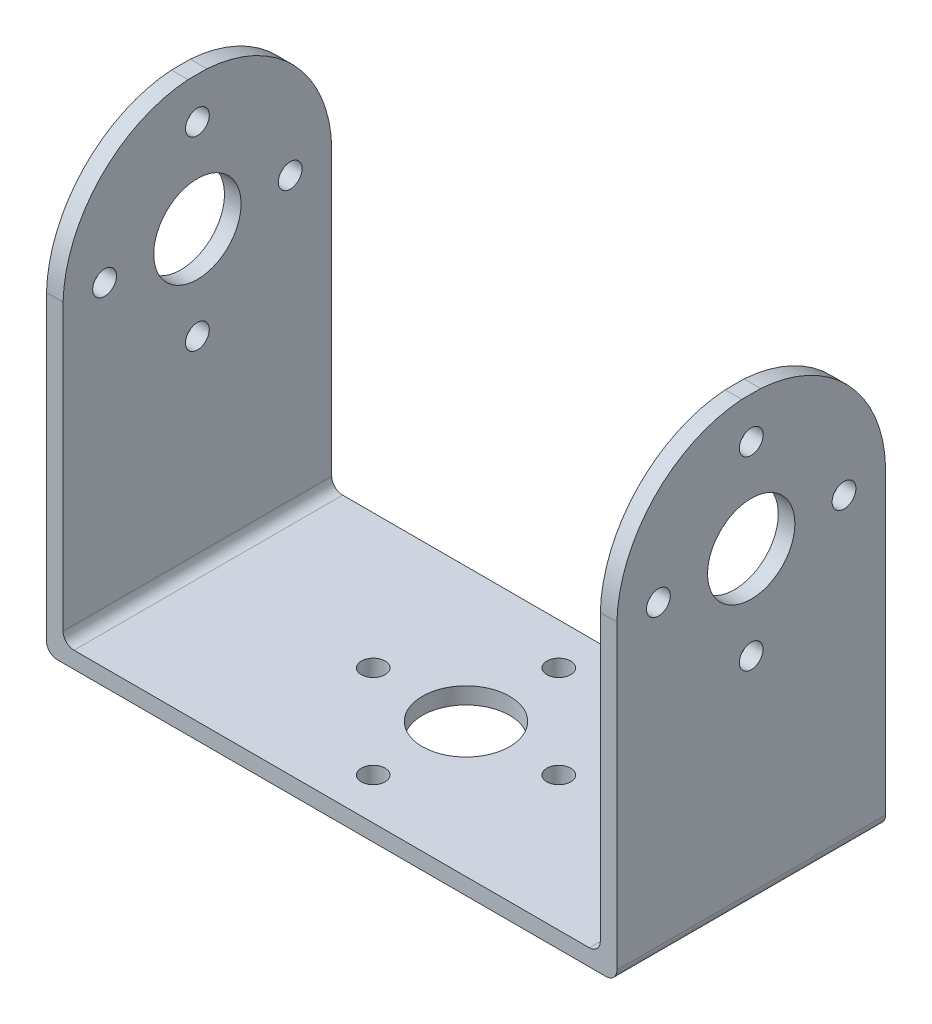
from build123d import *

# Parameters (mm, degrees)
BOSS_EXTRUDE1_DEPTH = 24.61
SKETCH2_R           = 4
CUT_EXTRUDE5_DEPTH  = 20
SKETCH4_R           = 1.09
CUT_EXTRUDE6_DEPTH  = 100
CIRPATTERN1_COUNT   = 4
SKETCH5_R           = 4
CUT_EXTRUDE7_DEPTH  = 50
SKETCH6_R           = 1.09
CUT_EXTRUDE8_DEPTH  = 50
CIRPATTERN2_COUNT   = 4
FILLET1_R           = 1
SKETCH7_W           = 24.61
SKETCH7_H           = 17.78
CUT_EXTRUDE9_DEPTH  = 100


with BuildPart() as part:
    # Sketch1 → Boss-Extrude1 (new body)
    with BuildSketch(Plane.XY):
        Polygon((-26.125, 58.34), (-26.125, 0), (26.125, 0), (26.125, 58.34), (24.605, 58.34), (24.605, 1.52), (-24.605, 1.52), (-24.605, 58.34), align=None)
    extrude(amount=BOSS_EXTRUDE1_DEPTH)

    # Sketch2 → Cut-Extrude5 (cut)
    with BuildSketch(Plane.ZY.offset(26.125)):
        with Locations(Location((12.305, 28.28, 0), (0, 0, 270))):
            Circle(SKETCH2_R)
        with BuildLine():
            Line((-0.005, 28.28), (-0.002957418, 40.56))
            Line((-0.002957418, 40.56), (11.446105362, 40.56))
            ThreePointArc((11.446105362, 40.56), (3.301970149, 36.675329267), (-0.005, 28.28))
        make_face()
        with BuildLine():
            Line((24.612957418, 40.56), (24.615, 28.28))
            ThreePointArc((24.615, 28.28), (21.308029851, 36.675329267), (13.163894638, 40.56))
            Line((13.163894638, 40.56), (24.612957418, 40.56))
        make_face()
    cut_extrude5 = extrude(amount=-CUT_EXTRUDE5_DEPTH, mode=Mode.SUBTRACT)

    # Mirror1: Cut-Extrude5 across plane
    add(cut_extrude5.mirror(Plane(origin=(0, 0, 0), x_dir=(0, 0, 1), z_dir=(1, 0, 0))), mode=Mode.SUBTRACT)

    # Sketch4 → Cut-Extrude6 (cut)
    with BuildSketch(Plane.ZY.offset(26.125)):
        with Locations(Location((12.305, 36.78, 0), (0, 0, 270))):
            Circle(SKETCH4_R)
    cut_extrude6 = extrude(amount=-CUT_EXTRUDE6_DEPTH, mode=Mode.SUBTRACT)

    # CirPattern1: Cut-Extrude6 ×4 about axis
    cirpattern1_axis = Axis((0, 28.28, 12.305), (1, 0, 0))
    for i in range(1, CIRPATTERN1_COUNT):
        add(cut_extrude6.rotate(cirpattern1_axis, i * 360 / CIRPATTERN1_COUNT), mode=Mode.SUBTRACT)

    # Sketch5 → Cut-Extrude7 (cut, symmetric)
    with BuildSketch(Plane(origin=(0, 1.52, 0), x_dir=(1, 0, 0), z_dir=(0, 1, 0))):
        with Locations(Location((0, -12.305, 0), (0, 0, 270))):
            Circle(SKETCH5_R)
    extrude(amount=CUT_EXTRUDE7_DEPTH, both=True, mode=Mode.SUBTRACT)

    # Sketch6 → Cut-Extrude8 (cut, symmetric)
    with BuildSketch(Plane(origin=(0, 1.52, 0), x_dir=(1, 0, 0), z_dir=(0, 1, 0))):
        with Locations(Location((0, -3.805, 0), (0, 0, 270))):
            Circle(SKETCH6_R)
    cut_extrude8 = extrude(amount=CUT_EXTRUDE8_DEPTH, both=True, mode=Mode.SUBTRACT)

    # CirPattern2: Cut-Extrude8 ×4 about axis
    cirpattern2_axis = Axis((0, 0, 12.305), (0, 1, 0))
    for i in range(1, CIRPATTERN2_COUNT):
        add(cut_extrude8.rotate(cirpattern2_axis, i * 360 / CIRPATTERN2_COUNT), mode=Mode.SUBTRACT)

    # Fillet1
    fillet1_edges = [part.edges().sort_by_distance(p)[0] for p in [
        (-24.605, 1.52, 12.305),
        (24.605, 1.52, 12.305),
        (26.125, 0, 12.305),
        (-26.125, 0, 12.305),
    ]]
    fillet(fillet1_edges, radius=FILLET1_R)

    # Sketch7 → Cut-Extrude9 (cut)
    with BuildSketch(Plane.ZY.offset(26.125)):
        with Locations((12.305, 49.45)):
            Rectangle(SKETCH7_W, SKETCH7_H)
    extrude(amount=-CUT_EXTRUDE9_DEPTH, mode=Mode.SUBTRACT)


solid = part.part
